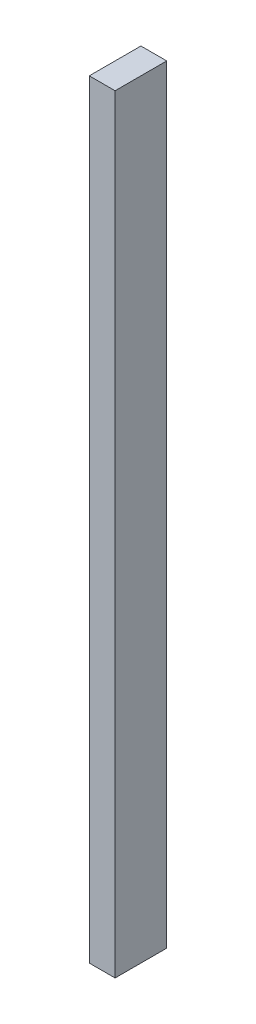
from build123d import *
from build123d.topology import SkipClean

# Parameters (mm, degrees)
SKETCH1_W           = 238
SKETCH1_H           = 8
SKETCH1_R           = 0.795
BOSS_EXTRUDE1_DEPTH = 16
LPATTERN1_COUNT     = 2
LPATTERN1_PITCH     = 2.5
LPATTERN3_COUNT     = 39
LPATTERN3_PITCH     = 6


with BuildPart() as part:
    # Sketch1 → Boss-Extrude1 (new body)
    # profile 1 of 5: a face of its own
    with BuildSketch(Plane(origin=(0, 0, 0), x_dir=(0, 1, 0), z_dir=(0, 0, 1))):
        with Locations((119, 4)):
            Rectangle(SKETCH1_W, SKETCH1_H)
        with Locations((2.5, 4)):
            Circle(SKETCH1_R, mode=Mode.SUBTRACT)
    # profile 2 of 5: a face of its own
    with BuildSketch(Plane(origin=(0, 0, 0), x_dir=(0, 1, 0), z_dir=(0, 0, 1))):
        with Locations((2.5, 4)):
            Circle(SKETCH1_R)
    # profile 3 of 5: a face of its own
    with BuildSketch(Plane(origin=(0, 0, 0), x_dir=(0, 1, 0), z_dir=(0, 0, 1))):
        with BuildLine():
            Line((2.5, 4.795), (2.5, 8))
            Line((2.5, 8), (0, 8))
            Line((0, 8), (0, 0))
            Line((0, 0), (2.5, 0))
            Line((2.5, 0), (2.5, 3.205))
            ThreePointArc((2.5, 3.205), (1.705, 4), (2.5, 4.795))
        make_face()
    # profile 4 of 5: a face of its own
    with BuildSketch(Plane(origin=(0, 0, 0), x_dir=(0, 1, 0), z_dir=(0, 0, 1))):
        with BuildLine():
            ThreePointArc((3.295, 4), (3.062149891, 4.562149891), (2.5, 4.795))
            Line((2.5, 4.795), (2.5, 3.205))
            ThreePointArc((2.5, 3.205), (3.062149891, 3.437850109), (3.295, 4))
        make_face()
    # profile 5 of 5: a face of its own
    with BuildSketch(Plane(origin=(0, 0, 0), x_dir=(0, 1, 0), z_dir=(0, 0, 1))):
        with BuildLine():
            Line((2.5, 3.205), (2.5, 4.795))
            ThreePointArc((2.5, 4.795), (1.705, 4), (2.5, 3.205))
        make_face()
    extrude(amount=BOSS_EXTRUDE1_DEPTH)

    # Sketch1<5> → Cut-Revolve1 (revolve, cut)
    with SkipClean():  # the faces are left unmerged after this step: merging them gives an invalid solid
        with BuildSketch(Plane(origin=(0, 0, 0), x_dir=(0, 1, 0), z_dir=(0, 0, 1))):
            with BuildLine():
                ThreePointArc((3.295, 4), (3.062149891, 4.562149891), (2.5, 4.795))
                Line((2.5, 4.795), (2.5, 3.205))
                ThreePointArc((2.5, 3.205), (3.062149891, 3.437850109), (3.295, 4))
            make_face()
            with BuildLine():
                Line((2.5, 3.205), (2.5, 4.795))
                ThreePointArc((2.5, 4.795), (1.705, 4), (2.5, 3.205))
            make_face()
        cut_revolve1 = revolve(axis=Axis((-8, 2.5, 0), (1, 0, 0)), mode=Mode.SUBTRACT)

    # LPattern1: Cut-Revolve1 ×2
    with Locations(*[(0, i * LPATTERN1_PITCH, 0) for i in range(1, LPATTERN1_COUNT)]):
        add(cut_revolve1, mode=Mode.SUBTRACT)

    # LPattern3: Cut-Revolve1 ×39
    with Locations(*[(0, i * LPATTERN3_PITCH, 0) for i in range(1, LPATTERN3_COUNT)]):
        add(cut_revolve1, mode=Mode.SUBTRACT)

    # LPattern3 copy 1 sketch → LPattern3 copy 1 (revolve, cut)
    with SkipClean():  # the faces are left unmerged after this step: merging them gives an invalid solid
        with BuildSketch(Plane(origin=(0, 8.5, 0), x_dir=(0, 1, 0), z_dir=(0, 0, 1))):
            with BuildLine():
                ThreePointArc((3.295, 4), (3.062149891, 4.562149891), (2.5, 4.795))
                Line((2.5, 4.795), (2.5, 3.205))
                ThreePointArc((2.5, 3.205), (3.062149891, 3.437850109), (3.295, 4))
            make_face()
            with BuildLine():
                Line((2.5, 3.205), (2.5, 4.795))
                ThreePointArc((2.5, 4.795), (1.705, 4), (2.5, 3.205))
            make_face()
        revolve(axis=Axis((-8, 11, 0), (1, 0, 0)), mode=Mode.SUBTRACT)

    # LPattern3 copy 2 sketch → LPattern3 copy 2 (revolve, cut)
    with SkipClean():  # the faces are left unmerged after this step: merging them gives an invalid solid
        with BuildSketch(Plane(origin=(0, 14.5, 0), x_dir=(0, 1, 0), z_dir=(0, 0, 1))):
            with BuildLine():
                ThreePointArc((3.295, 4), (3.062149891, 4.562149891), (2.5, 4.795))
                Line((2.5, 4.795), (2.5, 3.205))
                ThreePointArc((2.5, 3.205), (3.062149891, 3.437850109), (3.295, 4))
            make_face()
            with BuildLine():
                Line((2.5, 3.205), (2.5, 4.795))
                ThreePointArc((2.5, 4.795), (1.705, 4), (2.5, 3.205))
            make_face()
        revolve(axis=Axis((-8, 17, 0), (1, 0, 0)), mode=Mode.SUBTRACT)

    # LPattern3 copy 3 sketch → LPattern3 copy 3 (revolve, cut)
    with SkipClean():  # the faces are left unmerged after this step: merging them gives an invalid solid
        with BuildSketch(Plane(origin=(0, 20.5, 0), x_dir=(0, 1, 0), z_dir=(0, 0, 1))):
            with BuildLine():
                ThreePointArc((3.295, 4), (3.062149891, 4.562149891), (2.5, 4.795))
                Line((2.5, 4.795), (2.5, 3.205))
                ThreePointArc((2.5, 3.205), (3.062149891, 3.437850109), (3.295, 4))
            make_face()
            with BuildLine():
                Line((2.5, 3.205), (2.5, 4.795))
                ThreePointArc((2.5, 4.795), (1.705, 4), (2.5, 3.205))
            make_face()
        revolve(axis=Axis((-8, 23, 0), (1, 0, 0)), mode=Mode.SUBTRACT)

    # LPattern3 copy 4 sketch → LPattern3 copy 4 (revolve, cut)
    with SkipClean():  # the faces are left unmerged after this step: merging them gives an invalid solid
        with BuildSketch(Plane(origin=(0, 26.5, 0), x_dir=(0, 1, 0), z_dir=(0, 0, 1))):
            with BuildLine():
                ThreePointArc((3.295, 4), (3.062149891, 4.562149891), (2.5, 4.795))
                Line((2.5, 4.795), (2.5, 3.205))
                ThreePointArc((2.5, 3.205), (3.062149891, 3.437850109), (3.295, 4))
            make_face()
            with BuildLine():
                Line((2.5, 3.205), (2.5, 4.795))
                ThreePointArc((2.5, 4.795), (1.705, 4), (2.5, 3.205))
            make_face()
        revolve(axis=Axis((-8, 29, 0), (1, 0, 0)), mode=Mode.SUBTRACT)

    # LPattern3 copy 5 sketch → LPattern3 copy 5 (revolve, cut)
    with SkipClean():  # the faces are left unmerged after this step: merging them gives an invalid solid
        with BuildSketch(Plane(origin=(0, 32.5, 0), x_dir=(0, 1, 0), z_dir=(0, 0, 1))):
            with BuildLine():
                ThreePointArc((3.295, 4), (3.062149891, 4.562149891), (2.5, 4.795))
                Line((2.5, 4.795), (2.5, 3.205))
                ThreePointArc((2.5, 3.205), (3.062149891, 3.437850109), (3.295, 4))
            make_face()
            with BuildLine():
                Line((2.5, 3.205), (2.5, 4.795))
                ThreePointArc((2.5, 4.795), (1.705, 4), (2.5, 3.205))
            make_face()
        revolve(axis=Axis((-8, 35, 0), (1, 0, 0)), mode=Mode.SUBTRACT)

    # LPattern3 copy 6 sketch → LPattern3 copy 6 (revolve, cut)
    with SkipClean():  # the faces are left unmerged after this step: merging them gives an invalid solid
        with BuildSketch(Plane(origin=(0, 38.5, 0), x_dir=(0, 1, 0), z_dir=(0, 0, 1))):
            with BuildLine():
                ThreePointArc((3.295, 4), (3.062149891, 4.562149891), (2.5, 4.795))
                Line((2.5, 4.795), (2.5, 3.205))
                ThreePointArc((2.5, 3.205), (3.062149891, 3.437850109), (3.295, 4))
            make_face()
            with BuildLine():
                Line((2.5, 3.205), (2.5, 4.795))
                ThreePointArc((2.5, 4.795), (1.705, 4), (2.5, 3.205))
            make_face()
        revolve(axis=Axis((-8, 41, 0), (1, 0, 0)), mode=Mode.SUBTRACT)

    # LPattern3 copy 7 sketch → LPattern3 copy 7 (revolve, cut)
    with SkipClean():  # the faces are left unmerged after this step: merging them gives an invalid solid
        with BuildSketch(Plane(origin=(0, 44.5, 0), x_dir=(0, 1, 0), z_dir=(0, 0, 1))):
            with BuildLine():
                ThreePointArc((3.295, 4), (3.062149891, 4.562149891), (2.5, 4.795))
                Line((2.5, 4.795), (2.5, 3.205))
                ThreePointArc((2.5, 3.205), (3.062149891, 3.437850109), (3.295, 4))
            make_face()
            with BuildLine():
                Line((2.5, 3.205), (2.5, 4.795))
                ThreePointArc((2.5, 4.795), (1.705, 4), (2.5, 3.205))
            make_face()
        revolve(axis=Axis((-8, 47, 0), (1, 0, 0)), mode=Mode.SUBTRACT)

    # LPattern3 copy 8 sketch → LPattern3 copy 8 (revolve, cut)
    with SkipClean():  # the faces are left unmerged after this step: merging them gives an invalid solid
        with BuildSketch(Plane(origin=(0, 50.5, 0), x_dir=(0, 1, 0), z_dir=(0, 0, 1))):
            with BuildLine():
                ThreePointArc((3.295, 4), (3.062149891, 4.562149891), (2.5, 4.795))
                Line((2.5, 4.795), (2.5, 3.205))
                ThreePointArc((2.5, 3.205), (3.062149891, 3.437850109), (3.295, 4))
            make_face()
            with BuildLine():
                Line((2.5, 3.205), (2.5, 4.795))
                ThreePointArc((2.5, 4.795), (1.705, 4), (2.5, 3.205))
            make_face()
        revolve(axis=Axis((-8, 53, 0), (1, 0, 0)), mode=Mode.SUBTRACT)

    # LPattern3 copy 9 sketch → LPattern3 copy 9 (revolve, cut)
    with SkipClean():  # the faces are left unmerged after this step: merging them gives an invalid solid
        with BuildSketch(Plane(origin=(0, 56.5, 0), x_dir=(0, 1, 0), z_dir=(0, 0, 1))):
            with BuildLine():
                ThreePointArc((3.295, 4), (3.062149891, 4.562149891), (2.5, 4.795))
                Line((2.5, 4.795), (2.5, 3.205))
                ThreePointArc((2.5, 3.205), (3.062149891, 3.437850109), (3.295, 4))
            make_face()
            with BuildLine():
                Line((2.5, 3.205), (2.5, 4.795))
                ThreePointArc((2.5, 4.795), (1.705, 4), (2.5, 3.205))
            make_face()
        revolve(axis=Axis((-8, 59, 0), (1, 0, 0)), mode=Mode.SUBTRACT)

    # LPattern3 copy 10 sketch → LPattern3 copy 10 (revolve, cut)
    with SkipClean():  # the faces are left unmerged after this step: merging them gives an invalid solid
        with BuildSketch(Plane(origin=(0, 62.5, 0), x_dir=(0, 1, 0), z_dir=(0, 0, 1))):
            with BuildLine():
                ThreePointArc((3.295, 4), (3.062149891, 4.562149891), (2.5, 4.795))
                Line((2.5, 4.795), (2.5, 3.205))
                ThreePointArc((2.5, 3.205), (3.062149891, 3.437850109), (3.295, 4))
            make_face()
            with BuildLine():
                Line((2.5, 3.205), (2.5, 4.795))
                ThreePointArc((2.5, 4.795), (1.705, 4), (2.5, 3.205))
            make_face()
        revolve(axis=Axis((-8, 65, 0), (1, 0, 0)), mode=Mode.SUBTRACT)

    # LPattern3 copy 11 sketch → LPattern3 copy 11 (revolve, cut)
    with SkipClean():  # the faces are left unmerged after this step: merging them gives an invalid solid
        with BuildSketch(Plane(origin=(0, 68.5, 0), x_dir=(0, 1, 0), z_dir=(0, 0, 1))):
            with BuildLine():
                ThreePointArc((3.295, 4), (3.062149891, 4.562149891), (2.5, 4.795))
                Line((2.5, 4.795), (2.5, 3.205))
                ThreePointArc((2.5, 3.205), (3.062149891, 3.437850109), (3.295, 4))
            make_face()
            with BuildLine():
                Line((2.5, 3.205), (2.5, 4.795))
                ThreePointArc((2.5, 4.795), (1.705, 4), (2.5, 3.205))
            make_face()
        revolve(axis=Axis((-8, 71, 0), (1, 0, 0)), mode=Mode.SUBTRACT)

    # LPattern3 copy 12 sketch → LPattern3 copy 12 (revolve, cut)
    with SkipClean():  # the faces are left unmerged after this step: merging them gives an invalid solid
        with BuildSketch(Plane(origin=(0, 74.5, 0), x_dir=(0, 1, 0), z_dir=(0, 0, 1))):
            with BuildLine():
                ThreePointArc((3.295, 4), (3.062149891, 4.562149891), (2.5, 4.795))
                Line((2.5, 4.795), (2.5, 3.205))
                ThreePointArc((2.5, 3.205), (3.062149891, 3.437850109), (3.295, 4))
            make_face()
            with BuildLine():
                Line((2.5, 3.205), (2.5, 4.795))
                ThreePointArc((2.5, 4.795), (1.705, 4), (2.5, 3.205))
            make_face()
        revolve(axis=Axis((-8, 77, 0), (1, 0, 0)), mode=Mode.SUBTRACT)

    # LPattern3 copy 13 sketch → LPattern3 copy 13 (revolve, cut)
    with SkipClean():  # the faces are left unmerged after this step: merging them gives an invalid solid
        with BuildSketch(Plane(origin=(0, 80.5, 0), x_dir=(0, 1, 0), z_dir=(0, 0, 1))):
            with BuildLine():
                ThreePointArc((3.295, 4), (3.062149891, 4.562149891), (2.5, 4.795))
                Line((2.5, 4.795), (2.5, 3.205))
                ThreePointArc((2.5, 3.205), (3.062149891, 3.437850109), (3.295, 4))
            make_face()
            with BuildLine():
                Line((2.5, 3.205), (2.5, 4.795))
                ThreePointArc((2.5, 4.795), (1.705, 4), (2.5, 3.205))
            make_face()
        revolve(axis=Axis((-8, 83, 0), (1, 0, 0)), mode=Mode.SUBTRACT)

    # LPattern3 copy 14 sketch → LPattern3 copy 14 (revolve, cut)
    with SkipClean():  # the faces are left unmerged after this step: merging them gives an invalid solid
        with BuildSketch(Plane(origin=(0, 86.5, 0), x_dir=(0, 1, 0), z_dir=(0, 0, 1))):
            with BuildLine():
                ThreePointArc((3.295, 4), (3.062149891, 4.562149891), (2.5, 4.795))
                Line((2.5, 4.795), (2.5, 3.205))
                ThreePointArc((2.5, 3.205), (3.062149891, 3.437850109), (3.295, 4))
            make_face()
            with BuildLine():
                Line((2.5, 3.205), (2.5, 4.795))
                ThreePointArc((2.5, 4.795), (1.705, 4), (2.5, 3.205))
            make_face()
        revolve(axis=Axis((-8, 89, 0), (1, 0, 0)), mode=Mode.SUBTRACT)

    # LPattern3 copy 15 sketch → LPattern3 copy 15 (revolve, cut)
    with SkipClean():  # the faces are left unmerged after this step: merging them gives an invalid solid
        with BuildSketch(Plane(origin=(0, 92.5, 0), x_dir=(0, 1, 0), z_dir=(0, 0, 1))):
            with BuildLine():
                ThreePointArc((3.295, 4), (3.062149891, 4.562149891), (2.5, 4.795))
                Line((2.5, 4.795), (2.5, 3.205))
                ThreePointArc((2.5, 3.205), (3.062149891, 3.437850109), (3.295, 4))
            make_face()
            with BuildLine():
                Line((2.5, 3.205), (2.5, 4.795))
                ThreePointArc((2.5, 4.795), (1.705, 4), (2.5, 3.205))
            make_face()
        revolve(axis=Axis((-8, 95, 0), (1, 0, 0)), mode=Mode.SUBTRACT)

    # LPattern3 copy 16 sketch → LPattern3 copy 16 (revolve, cut)
    with SkipClean():  # the faces are left unmerged after this step: merging them gives an invalid solid
        with BuildSketch(Plane(origin=(0, 98.5, 0), x_dir=(0, 1, 0), z_dir=(0, 0, 1))):
            with BuildLine():
                ThreePointArc((3.295, 4), (3.062149891, 4.562149891), (2.5, 4.795))
                Line((2.5, 4.795), (2.5, 3.205))
                ThreePointArc((2.5, 3.205), (3.062149891, 3.437850109), (3.295, 4))
            make_face()
            with BuildLine():
                Line((2.5, 3.205), (2.5, 4.795))
                ThreePointArc((2.5, 4.795), (1.705, 4), (2.5, 3.205))
            make_face()
        revolve(axis=Axis((-8, 101, 0), (1, 0, 0)), mode=Mode.SUBTRACT)

    # LPattern3 copy 17 sketch → LPattern3 copy 17 (revolve, cut)
    with SkipClean():  # the faces are left unmerged after this step: merging them gives an invalid solid
        with BuildSketch(Plane(origin=(0, 104.5, 0), x_dir=(0, 1, 0), z_dir=(0, 0, 1))):
            with BuildLine():
                ThreePointArc((3.295, 4), (3.062149891, 4.562149891), (2.5, 4.795))
                Line((2.5, 4.795), (2.5, 3.205))
                ThreePointArc((2.5, 3.205), (3.062149891, 3.437850109), (3.295, 4))
            make_face()
            with BuildLine():
                Line((2.5, 3.205), (2.5, 4.795))
                ThreePointArc((2.5, 4.795), (1.705, 4), (2.5, 3.205))
            make_face()
        revolve(axis=Axis((-8, 107, 0), (1, 0, 0)), mode=Mode.SUBTRACT)

    # LPattern3 copy 18 sketch → LPattern3 copy 18 (revolve, cut)
    with SkipClean():  # the faces are left unmerged after this step: merging them gives an invalid solid
        with BuildSketch(Plane(origin=(0, 110.5, 0), x_dir=(0, 1, 0), z_dir=(0, 0, 1))):
            with BuildLine():
                ThreePointArc((3.295, 4), (3.062149891, 4.562149891), (2.5, 4.795))
                Line((2.5, 4.795), (2.5, 3.205))
                ThreePointArc((2.5, 3.205), (3.062149891, 3.437850109), (3.295, 4))
            make_face()
            with BuildLine():
                Line((2.5, 3.205), (2.5, 4.795))
                ThreePointArc((2.5, 4.795), (1.705, 4), (2.5, 3.205))
            make_face()
        revolve(axis=Axis((-8, 113, 0), (1, 0, 0)), mode=Mode.SUBTRACT)

    # LPattern3 copy 19 sketch → LPattern3 copy 19 (revolve, cut)
    with SkipClean():  # the faces are left unmerged after this step: merging them gives an invalid solid
        with BuildSketch(Plane(origin=(0, 116.5, 0), x_dir=(0, 1, 0), z_dir=(0, 0, 1))):
            with BuildLine():
                ThreePointArc((3.295, 4), (3.062149891, 4.562149891), (2.5, 4.795))
                Line((2.5, 4.795), (2.5, 3.205))
                ThreePointArc((2.5, 3.205), (3.062149891, 3.437850109), (3.295, 4))
            make_face()
            with BuildLine():
                Line((2.5, 3.205), (2.5, 4.795))
                ThreePointArc((2.5, 4.795), (1.705, 4), (2.5, 3.205))
            make_face()
        revolve(axis=Axis((-8, 119, 0), (1, 0, 0)), mode=Mode.SUBTRACT)

    # LPattern3 copy 20 sketch → LPattern3 copy 20 (revolve, cut)
    with SkipClean():  # the faces are left unmerged after this step: merging them gives an invalid solid
        with BuildSketch(Plane(origin=(0, 122.5, 0), x_dir=(0, 1, 0), z_dir=(0, 0, 1))):
            with BuildLine():
                ThreePointArc((3.295, 4), (3.062149891, 4.562149891), (2.5, 4.795))
                Line((2.5, 4.795), (2.5, 3.205))
                ThreePointArc((2.5, 3.205), (3.062149891, 3.437850109), (3.295, 4))
            make_face()
            with BuildLine():
                Line((2.5, 3.205), (2.5, 4.795))
                ThreePointArc((2.5, 4.795), (1.705, 4), (2.5, 3.205))
            make_face()
        revolve(axis=Axis((-8, 125, 0), (1, 0, 0)), mode=Mode.SUBTRACT)

    # LPattern3 copy 21 sketch → LPattern3 copy 21 (revolve, cut)
    with SkipClean():  # the faces are left unmerged after this step: merging them gives an invalid solid
        with BuildSketch(Plane(origin=(0, 128.5, 0), x_dir=(0, 1, 0), z_dir=(0, 0, 1))):
            with BuildLine():
                ThreePointArc((3.295, 4), (3.062149891, 4.562149891), (2.5, 4.795))
                Line((2.5, 4.795), (2.5, 3.205))
                ThreePointArc((2.5, 3.205), (3.062149891, 3.437850109), (3.295, 4))
            make_face()
            with BuildLine():
                Line((2.5, 3.205), (2.5, 4.795))
                ThreePointArc((2.5, 4.795), (1.705, 4), (2.5, 3.205))
            make_face()
        revolve(axis=Axis((-8, 131, 0), (1, 0, 0)), mode=Mode.SUBTRACT)

    # LPattern3 copy 22 sketch → LPattern3 copy 22 (revolve, cut)
    with SkipClean():  # the faces are left unmerged after this step: merging them gives an invalid solid
        with BuildSketch(Plane(origin=(0, 134.5, 0), x_dir=(0, 1, 0), z_dir=(0, 0, 1))):
            with BuildLine():
                ThreePointArc((3.295, 4), (3.062149891, 4.562149891), (2.5, 4.795))
                Line((2.5, 4.795), (2.5, 3.205))
                ThreePointArc((2.5, 3.205), (3.062149891, 3.437850109), (3.295, 4))
            make_face()
            with BuildLine():
                Line((2.5, 3.205), (2.5, 4.795))
                ThreePointArc((2.5, 4.795), (1.705, 4), (2.5, 3.205))
            make_face()
        revolve(axis=Axis((-8, 137, 0), (1, 0, 0)), mode=Mode.SUBTRACT)

    # LPattern3 copy 23 sketch → LPattern3 copy 23 (revolve, cut)
    with SkipClean():  # the faces are left unmerged after this step: merging them gives an invalid solid
        with BuildSketch(Plane(origin=(0, 140.5, 0), x_dir=(0, 1, 0), z_dir=(0, 0, 1))):
            with BuildLine():
                ThreePointArc((3.295, 4), (3.062149891, 4.562149891), (2.5, 4.795))
                Line((2.5, 4.795), (2.5, 3.205))
                ThreePointArc((2.5, 3.205), (3.062149891, 3.437850109), (3.295, 4))
            make_face()
            with BuildLine():
                Line((2.5, 3.205), (2.5, 4.795))
                ThreePointArc((2.5, 4.795), (1.705, 4), (2.5, 3.205))
            make_face()
        revolve(axis=Axis((-8, 143, 0), (1, 0, 0)), mode=Mode.SUBTRACT)

    # LPattern3 copy 24 sketch → LPattern3 copy 24 (revolve, cut)
    with SkipClean():  # the faces are left unmerged after this step: merging them gives an invalid solid
        with BuildSketch(Plane(origin=(0, 146.5, 0), x_dir=(0, 1, 0), z_dir=(0, 0, 1))):
            with BuildLine():
                ThreePointArc((3.295, 4), (3.062149891, 4.562149891), (2.5, 4.795))
                Line((2.5, 4.795), (2.5, 3.205))
                ThreePointArc((2.5, 3.205), (3.062149891, 3.437850109), (3.295, 4))
            make_face()
            with BuildLine():
                Line((2.5, 3.205), (2.5, 4.795))
                ThreePointArc((2.5, 4.795), (1.705, 4), (2.5, 3.205))
            make_face()
        revolve(axis=Axis((-8, 149, 0), (1, 0, 0)), mode=Mode.SUBTRACT)

    # LPattern3 copy 25 sketch → LPattern3 copy 25 (revolve, cut)
    with SkipClean():  # the faces are left unmerged after this step: merging them gives an invalid solid
        with BuildSketch(Plane(origin=(0, 152.5, 0), x_dir=(0, 1, 0), z_dir=(0, 0, 1))):
            with BuildLine():
                ThreePointArc((3.295, 4), (3.062149891, 4.562149891), (2.5, 4.795))
                Line((2.5, 4.795), (2.5, 3.205))
                ThreePointArc((2.5, 3.205), (3.062149891, 3.437850109), (3.295, 4))
            make_face()
            with BuildLine():
                Line((2.5, 3.205), (2.5, 4.795))
                ThreePointArc((2.5, 4.795), (1.705, 4), (2.5, 3.205))
            make_face()
        revolve(axis=Axis((-8, 155, 0), (1, 0, 0)), mode=Mode.SUBTRACT)

    # LPattern3 copy 26 sketch → LPattern3 copy 26 (revolve, cut)
    with SkipClean():  # the faces are left unmerged after this step: merging them gives an invalid solid
        with BuildSketch(Plane(origin=(0, 158.5, 0), x_dir=(0, 1, 0), z_dir=(0, 0, 1))):
            with BuildLine():
                ThreePointArc((3.295, 4), (3.062149891, 4.562149891), (2.5, 4.795))
                Line((2.5, 4.795), (2.5, 3.205))
                ThreePointArc((2.5, 3.205), (3.062149891, 3.437850109), (3.295, 4))
            make_face()
            with BuildLine():
                Line((2.5, 3.205), (2.5, 4.795))
                ThreePointArc((2.5, 4.795), (1.705, 4), (2.5, 3.205))
            make_face()
        revolve(axis=Axis((-8, 161, 0), (1, 0, 0)), mode=Mode.SUBTRACT)

    # LPattern3 copy 27 sketch → LPattern3 copy 27 (revolve, cut)
    with SkipClean():  # the faces are left unmerged after this step: merging them gives an invalid solid
        with BuildSketch(Plane(origin=(0, 164.5, 0), x_dir=(0, 1, 0), z_dir=(0, 0, 1))):
            with BuildLine():
                ThreePointArc((3.295, 4), (3.062149891, 4.562149891), (2.5, 4.795))
                Line((2.5, 4.795), (2.5, 3.205))
                ThreePointArc((2.5, 3.205), (3.062149891, 3.437850109), (3.295, 4))
            make_face()
            with BuildLine():
                Line((2.5, 3.205), (2.5, 4.795))
                ThreePointArc((2.5, 4.795), (1.705, 4), (2.5, 3.205))
            make_face()
        revolve(axis=Axis((-8, 167, 0), (1, 0, 0)), mode=Mode.SUBTRACT)

    # LPattern3 copy 28 sketch → LPattern3 copy 28 (revolve, cut)
    with SkipClean():  # the faces are left unmerged after this step: merging them gives an invalid solid
        with BuildSketch(Plane(origin=(0, 170.5, 0), x_dir=(0, 1, 0), z_dir=(0, 0, 1))):
            with BuildLine():
                ThreePointArc((3.295, 4), (3.062149891, 4.562149891), (2.5, 4.795))
                Line((2.5, 4.795), (2.5, 3.205))
                ThreePointArc((2.5, 3.205), (3.062149891, 3.437850109), (3.295, 4))
            make_face()
            with BuildLine():
                Line((2.5, 3.205), (2.5, 4.795))
                ThreePointArc((2.5, 4.795), (1.705, 4), (2.5, 3.205))
            make_face()
        revolve(axis=Axis((-8, 173, 0), (1, 0, 0)), mode=Mode.SUBTRACT)

    # LPattern3 copy 29 sketch → LPattern3 copy 29 (revolve, cut)
    with SkipClean():  # the faces are left unmerged after this step: merging them gives an invalid solid
        with BuildSketch(Plane(origin=(0, 176.5, 0), x_dir=(0, 1, 0), z_dir=(0, 0, 1))):
            with BuildLine():
                ThreePointArc((3.295, 4), (3.062149891, 4.562149891), (2.5, 4.795))
                Line((2.5, 4.795), (2.5, 3.205))
                ThreePointArc((2.5, 3.205), (3.062149891, 3.437850109), (3.295, 4))
            make_face()
            with BuildLine():
                Line((2.5, 3.205), (2.5, 4.795))
                ThreePointArc((2.5, 4.795), (1.705, 4), (2.5, 3.205))
            make_face()
        revolve(axis=Axis((-8, 179, 0), (1, 0, 0)), mode=Mode.SUBTRACT)

    # LPattern3 copy 30 sketch → LPattern3 copy 30 (revolve, cut)
    with SkipClean():  # the faces are left unmerged after this step: merging them gives an invalid solid
        with BuildSketch(Plane(origin=(0, 182.5, 0), x_dir=(0, 1, 0), z_dir=(0, 0, 1))):
            with BuildLine():
                ThreePointArc((3.295, 4), (3.062149891, 4.562149891), (2.5, 4.795))
                Line((2.5, 4.795), (2.5, 3.205))
                ThreePointArc((2.5, 3.205), (3.062149891, 3.437850109), (3.295, 4))
            make_face()
            with BuildLine():
                Line((2.5, 3.205), (2.5, 4.795))
                ThreePointArc((2.5, 4.795), (1.705, 4), (2.5, 3.205))
            make_face()
        revolve(axis=Axis((-8, 185, 0), (1, 0, 0)), mode=Mode.SUBTRACT)

    # LPattern3 copy 31 sketch → LPattern3 copy 31 (revolve, cut)
    with SkipClean():  # the faces are left unmerged after this step: merging them gives an invalid solid
        with BuildSketch(Plane(origin=(0, 188.5, 0), x_dir=(0, 1, 0), z_dir=(0, 0, 1))):
            with BuildLine():
                ThreePointArc((3.295, 4), (3.062149891, 4.562149891), (2.5, 4.795))
                Line((2.5, 4.795), (2.5, 3.205))
                ThreePointArc((2.5, 3.205), (3.062149891, 3.437850109), (3.295, 4))
            make_face()
            with BuildLine():
                Line((2.5, 3.205), (2.5, 4.795))
                ThreePointArc((2.5, 4.795), (1.705, 4), (2.5, 3.205))
            make_face()
        revolve(axis=Axis((-8, 191, 0), (1, 0, 0)), mode=Mode.SUBTRACT)

    # LPattern3 copy 32 sketch → LPattern3 copy 32 (revolve, cut)
    with SkipClean():  # the faces are left unmerged after this step: merging them gives an invalid solid
        with BuildSketch(Plane(origin=(0, 194.5, 0), x_dir=(0, 1, 0), z_dir=(0, 0, 1))):
            with BuildLine():
                ThreePointArc((3.295, 4), (3.062149891, 4.562149891), (2.5, 4.795))
                Line((2.5, 4.795), (2.5, 3.205))
                ThreePointArc((2.5, 3.205), (3.062149891, 3.437850109), (3.295, 4))
            make_face()
            with BuildLine():
                Line((2.5, 3.205), (2.5, 4.795))
                ThreePointArc((2.5, 4.795), (1.705, 4), (2.5, 3.205))
            make_face()
        revolve(axis=Axis((-8, 197, 0), (1, 0, 0)), mode=Mode.SUBTRACT)

    # LPattern3 copy 33 sketch → LPattern3 copy 33 (revolve, cut)
    with SkipClean():  # the faces are left unmerged after this step: merging them gives an invalid solid
        with BuildSketch(Plane(origin=(0, 200.5, 0), x_dir=(0, 1, 0), z_dir=(0, 0, 1))):
            with BuildLine():
                ThreePointArc((3.295, 4), (3.062149891, 4.562149891), (2.5, 4.795))
                Line((2.5, 4.795), (2.5, 3.205))
                ThreePointArc((2.5, 3.205), (3.062149891, 3.437850109), (3.295, 4))
            make_face()
            with BuildLine():
                Line((2.5, 3.205), (2.5, 4.795))
                ThreePointArc((2.5, 4.795), (1.705, 4), (2.5, 3.205))
            make_face()
        revolve(axis=Axis((-8, 203, 0), (1, 0, 0)), mode=Mode.SUBTRACT)

    # LPattern3 copy 34 sketch → LPattern3 copy 34 (revolve, cut)
    with SkipClean():  # the faces are left unmerged after this step: merging them gives an invalid solid
        with BuildSketch(Plane(origin=(0, 206.5, 0), x_dir=(0, 1, 0), z_dir=(0, 0, 1))):
            with BuildLine():
                ThreePointArc((3.295, 4), (3.062149891, 4.562149891), (2.5, 4.795))
                Line((2.5, 4.795), (2.5, 3.205))
                ThreePointArc((2.5, 3.205), (3.062149891, 3.437850109), (3.295, 4))
            make_face()
            with BuildLine():
                Line((2.5, 3.205), (2.5, 4.795))
                ThreePointArc((2.5, 4.795), (1.705, 4), (2.5, 3.205))
            make_face()
        revolve(axis=Axis((-8, 209, 0), (1, 0, 0)), mode=Mode.SUBTRACT)

    # LPattern3 copy 35 sketch → LPattern3 copy 35 (revolve, cut)
    with SkipClean():  # the faces are left unmerged after this step: merging them gives an invalid solid
        with BuildSketch(Plane(origin=(0, 212.5, 0), x_dir=(0, 1, 0), z_dir=(0, 0, 1))):
            with BuildLine():
                ThreePointArc((3.295, 4), (3.062149891, 4.562149891), (2.5, 4.795))
                Line((2.5, 4.795), (2.5, 3.205))
                ThreePointArc((2.5, 3.205), (3.062149891, 3.437850109), (3.295, 4))
            make_face()
            with BuildLine():
                Line((2.5, 3.205), (2.5, 4.795))
                ThreePointArc((2.5, 4.795), (1.705, 4), (2.5, 3.205))
            make_face()
        revolve(axis=Axis((-8, 215, 0), (1, 0, 0)), mode=Mode.SUBTRACT)

    # LPattern3 copy 36 sketch → LPattern3 copy 36 (revolve, cut)
    with SkipClean():  # the faces are left unmerged after this step: merging them gives an invalid solid
        with BuildSketch(Plane(origin=(0, 218.5, 0), x_dir=(0, 1, 0), z_dir=(0, 0, 1))):
            with BuildLine():
                ThreePointArc((3.295, 4), (3.062149891, 4.562149891), (2.5, 4.795))
                Line((2.5, 4.795), (2.5, 3.205))
                ThreePointArc((2.5, 3.205), (3.062149891, 3.437850109), (3.295, 4))
            make_face()
            with BuildLine():
                Line((2.5, 3.205), (2.5, 4.795))
                ThreePointArc((2.5, 4.795), (1.705, 4), (2.5, 3.205))
            make_face()
        revolve(axis=Axis((-8, 221, 0), (1, 0, 0)), mode=Mode.SUBTRACT)

    # LPattern3 copy 37 sketch → LPattern3 copy 37 (revolve, cut)
    with SkipClean():  # the faces are left unmerged after this step: merging them gives an invalid solid
        with BuildSketch(Plane(origin=(0, 224.5, 0), x_dir=(0, 1, 0), z_dir=(0, 0, 1))):
            with BuildLine():
                ThreePointArc((3.295, 4), (3.062149891, 4.562149891), (2.5, 4.795))
                Line((2.5, 4.795), (2.5, 3.205))
                ThreePointArc((2.5, 3.205), (3.062149891, 3.437850109), (3.295, 4))
            make_face()
            with BuildLine():
                Line((2.5, 3.205), (2.5, 4.795))
                ThreePointArc((2.5, 4.795), (1.705, 4), (2.5, 3.205))
            make_face()
        revolve(axis=Axis((-8, 227, 0), (1, 0, 0)), mode=Mode.SUBTRACT)

    # LPattern3 copy 38 sketch → LPattern3 copy 38 (revolve, cut)
    with SkipClean():  # the faces are left unmerged after this step: merging them gives an invalid solid
        with BuildSketch(Plane(origin=(0, 230.5, 0), x_dir=(0, 1, 0), z_dir=(0, 0, 1))):
            with BuildLine():
                ThreePointArc((3.295, 4), (3.062149891, 4.562149891), (2.5, 4.795))
                Line((2.5, 4.795), (2.5, 3.205))
                ThreePointArc((2.5, 3.205), (3.062149891, 3.437850109), (3.295, 4))
            make_face()
            with BuildLine():
                Line((2.5, 3.205), (2.5, 4.795))
                ThreePointArc((2.5, 4.795), (1.705, 4), (2.5, 3.205))
            make_face()
        revolve(axis=Axis((-8, 233, 0), (1, 0, 0)), mode=Mode.SUBTRACT)


solid = part.part
